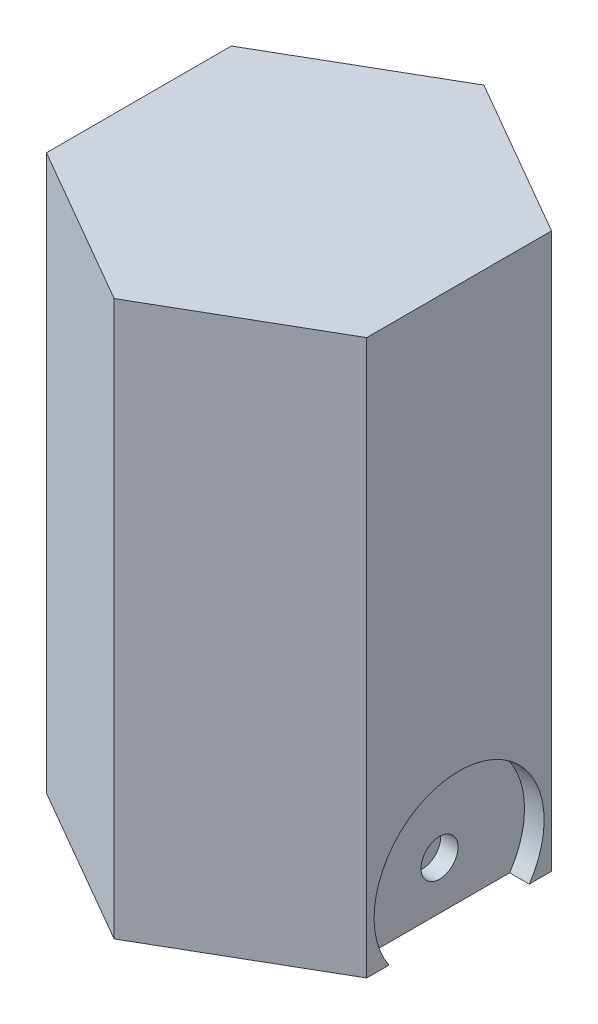
from build123d import *

# Parameters (mm, degrees)
BOSS_EXTRUDE1_START = 10
BOSS_EXTRUDE1_DEPTH = 150
CUT_EXTRUDE1_START  = -38
SKETCH3_R           = 23
CUT_EXTRUDE1_DEPTH  = 81.301270189
CUT_EXTRUDE2_START  = -33.3
SKETCH4_R           = 5
CUT_EXTRUDE2_DEPTH  = 4.7


with BuildPart() as part:
    # Sketch1 → Boss-Extrude1 (new body)
    with BuildSketch(Plane(origin=(0, 0, 0), x_dir=(1, 0, 0), z_dir=(0, 1, 0)).offset(BOSS_EXTRUDE1_START)):
        Polygon((0, 50), (-43.301270189, 25), (-43.301270189, -25), (0, -50), (43.301270189, -25), (43.301270189, 25), align=None)
    extrude(amount=BOSS_EXTRUDE1_DEPTH)

    # Sketch3 → Cut-Extrude1 (cut)
    with BuildSketch(Plane(origin=(0, 0, 0), x_dir=(0, 0, -1), z_dir=(1, 0, 0)).offset(CUT_EXTRUDE1_START)):
        with Locations((0, 23)):
            Circle(SKETCH3_R)
    cut_extrude1 = extrude(amount=-CUT_EXTRUDE1_DEPTH, mode=Mode.SUBTRACT)

    # Sketch4 → Cut-Extrude2 (cut)
    with BuildSketch(Plane(origin=(0, 0, 0), x_dir=(0, 0, -1), z_dir=(1, 0, 0)).offset(CUT_EXTRUDE2_START)):
        with Locations((0, 23)):
            Circle(SKETCH4_R)
    cut_extrude2 = extrude(amount=-CUT_EXTRUDE2_DEPTH, mode=Mode.SUBTRACT)

    # Mirror4: Cut-Extrude1, Cut-Extrude2 across plane
    add(cut_extrude1.mirror(Plane(origin=(0, 0, 0), x_dir=(0, 0, 1), z_dir=(1, 0, 0))), mode=Mode.SUBTRACT)
    add(cut_extrude2.mirror(Plane(origin=(0, 0, 0), x_dir=(0, 0, 1), z_dir=(1, 0, 0))), mode=Mode.SUBTRACT)


solid = part.part
